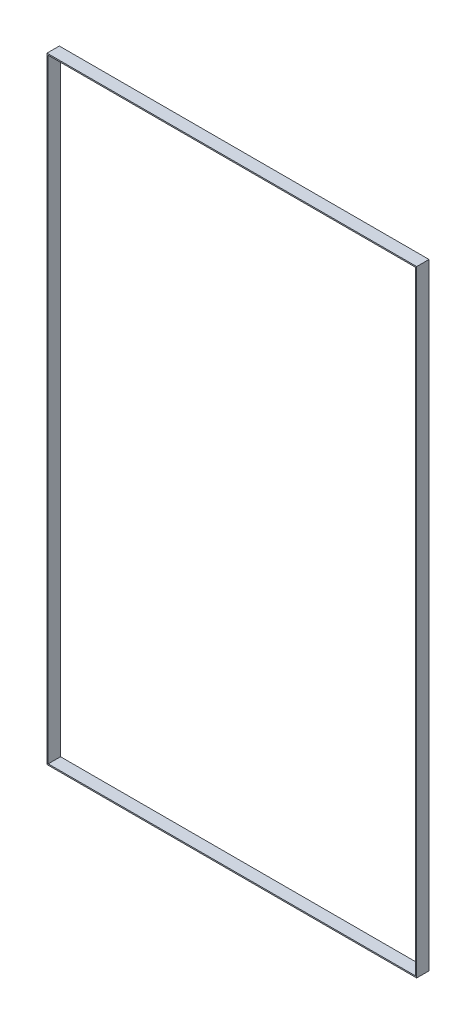
from build123d import *

# Parameters (mm, degrees)
SKETCH1_W           = 600
SKETCH1_H           = 1000
SKETCH1_W_2         = 596
SKETCH1_H_2         = 996
BOSS_EXTRUDE1_DEPTH = 20


with BuildPart() as part:
    # Sketch1 → Boss-Extrude1 (new body)
    with BuildSketch(Plane.XY):
        Rectangle(SKETCH1_W, SKETCH1_H)
        Rectangle(SKETCH1_W_2, SKETCH1_H_2, mode=Mode.SUBTRACT)
    extrude(amount=BOSS_EXTRUDE1_DEPTH)


solid = part.part
